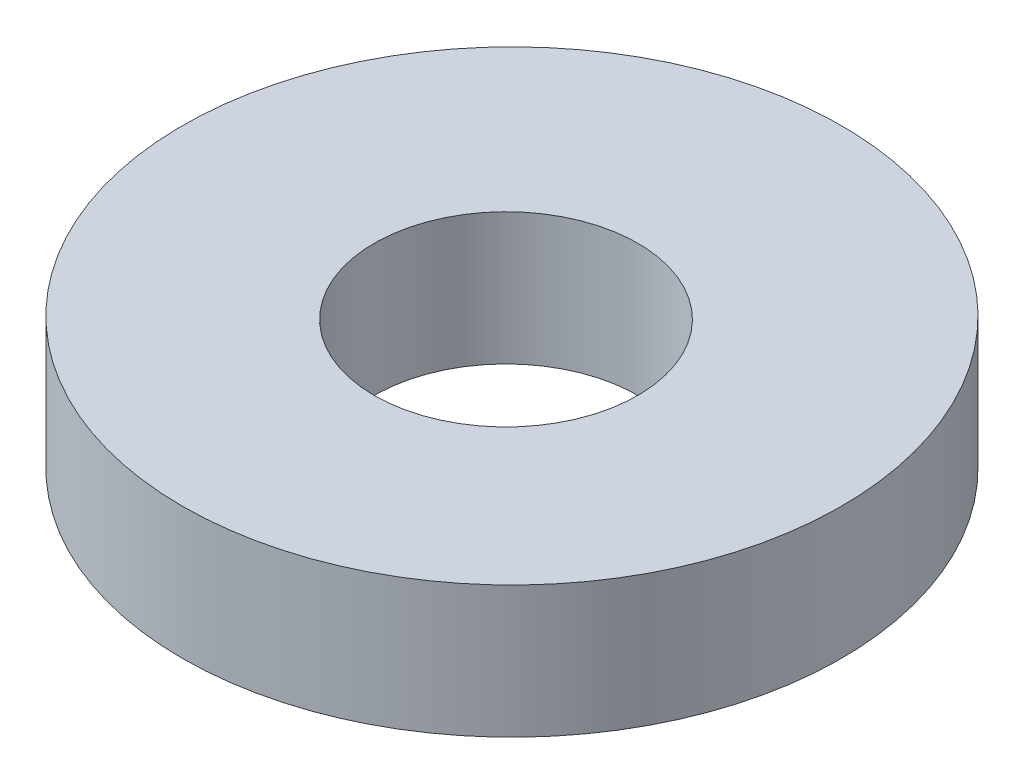
from build123d import *

# Parameters (mm, degrees)
SKETCH1_R           = 12.5
SKETCH1_R_2         = 5
BOSS_EXTRUDE1_DEPTH = 5


with BuildPart() as part:
    # Sketch1 → Boss-Extrude1 (new body)
    with BuildSketch(Plane(origin=(0, 0, 0), x_dir=(1, 0, 0), z_dir=(0, 1, 0))):
        with Locations(Location((0, 0, 0), (0, 0, 270))):
            Circle(SKETCH1_R)
        with Locations(Location((0, -0.224617504, 0), (0, 0, 270))):
            Circle(SKETCH1_R_2, mode=Mode.SUBTRACT)
    extrude(amount=BOSS_EXTRUDE1_DEPTH)


solid = part.part
